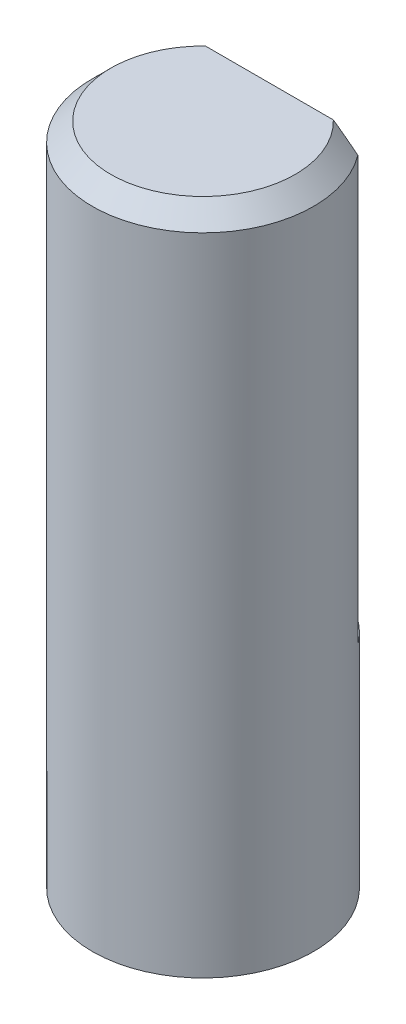
from build123d import *

# Parameters (mm, degrees)
SKETCH_1_R          = 3
EXTRUDE_1_DEPTH     = 18
CHAMFER_1_SIZE      = 0.5
CUT_EXTRUDE_START   = -12
CUT_EXTRUDE_1_DEPTH = 12


with BuildPart() as part:
    # Эскиз1 → Бобышка-Вытянуть1 (new body)
    with BuildSketch(Plane(origin=(0, 0, 0), x_dir=(1, 0, 0), z_dir=(0, 1, 0))):
        with Locations(Location((0, 0, 0), (0, 0, 270))):
            Circle(SKETCH_1_R)
    extrude(amount=EXTRUDE_1_DEPTH)

    # Фаска1
    chamfer_1_edges = [part.edges().sort_by_distance(p)[0] for p in [
        (0, 18, -3),
    ]]
    chamfer(chamfer_1_edges, length=CHAMFER_1_SIZE)

    # Эскиз2 → Вырез-Вытянуть1 (cut)
    with BuildSketch(Plane(origin=(0, 18, 0), x_dir=(1, 0, 0), z_dir=(0, 1, 0)).offset(CUT_EXTRUDE_START)):
        with BuildLine():
            Line((-2.4, 1.8), (2.4, 1.8))
            ThreePointArc((2.4, 1.8), (0, 3), (-2.4, 1.8))
        make_face()
    extrude(amount=CUT_EXTRUDE_1_DEPTH, mode=Mode.SUBTRACT)


solid = part.part
